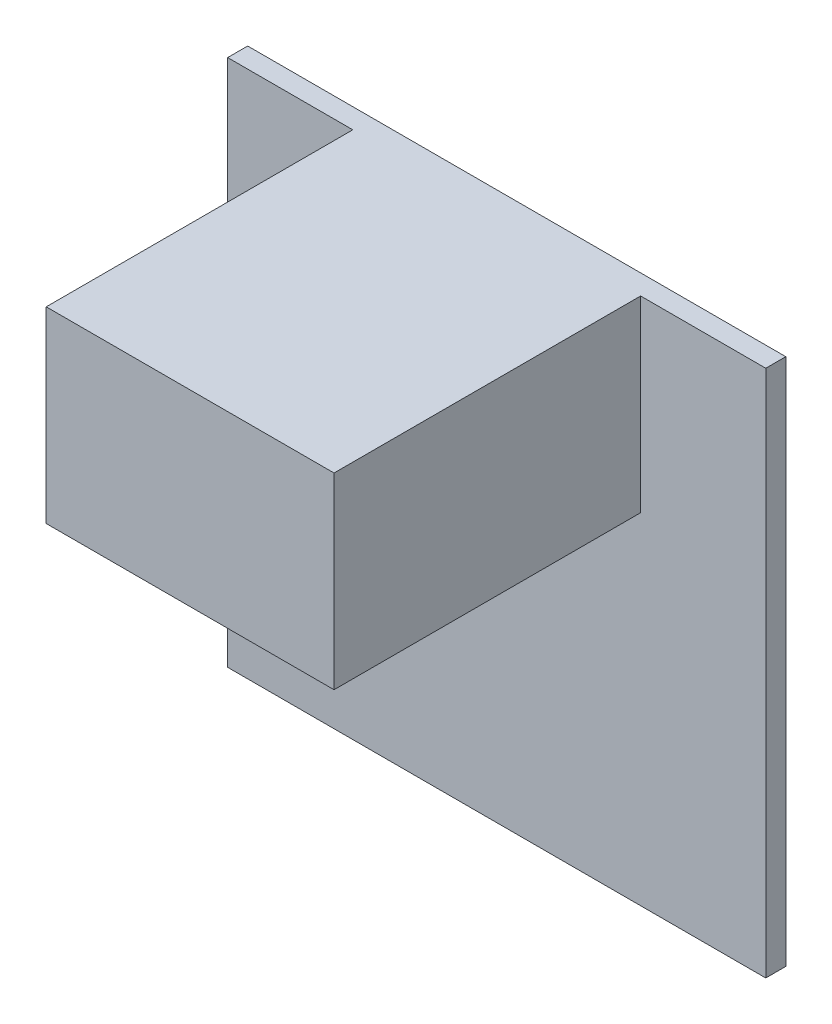
from build123d import *

# Parameters (mm, degrees)
SKETCH_1_W      = 43
SKETCH_1_H      = 42.2
EXTRUDE_1_DEPTH = 1.6
SKETCH_2_W      = 23
SKETCH_2_H      = 15
EXTRUDE_3_DEPTH = 24.5


with BuildPart() as part:
    # 草图1 → 凸台-拉伸1 (new body)
    with BuildSketch(Plane.XY):
        with Locations((21.5, 21.1)):
            Rectangle(SKETCH_1_W, SKETCH_1_H)
    extrude(amount=EXTRUDE_1_DEPTH)

    # 草图2 → 凸台-拉伸3 (add)
    with BuildSketch(Plane.XY.offset(1.6)):
        with Locations((21.5, 34.7)):
            Rectangle(SKETCH_2_W, SKETCH_2_H)
    extrude(amount=EXTRUDE_3_DEPTH)


solid = part.part
